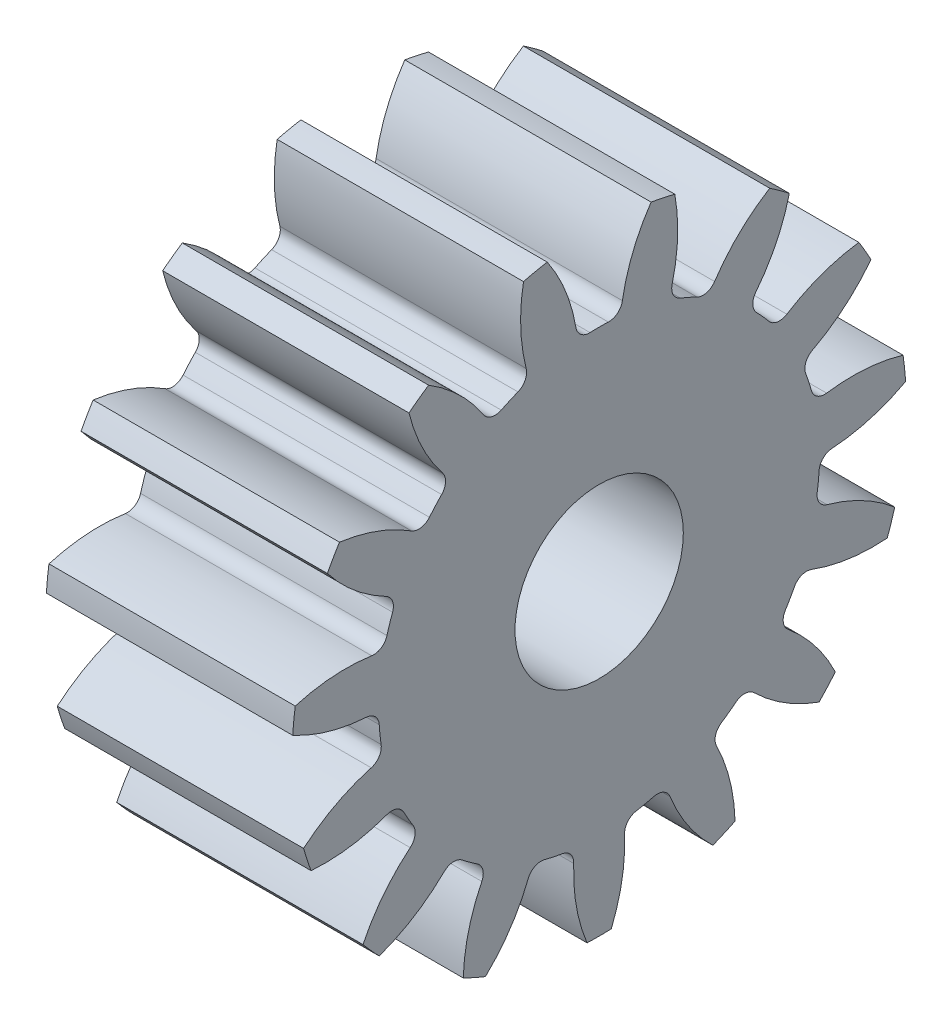
from build123d import *

# Parameters (mm, degrees)
SKETCH1_R                = 9.35
SKETCH1_R_2              = 2.5625
BOSS_EXTRUDE2_DEPTH      = 7.5
CUT_EXTRUDE1_DEPTH       = 16.201809103
FILLET1_R                = 0.418
CIRPATTERN2_COUNT        = 15
FILLET1_OF_CIRPATTERN2_R = 0.418
CUT_EXTRUDE2_REACH       = 25.487
CUT_EXTRUDE2_END_RADIUS  = 2.5625
SKETCH4_R                = 1.5875


with BuildPart() as part:
    # Sketch1 → Boss-Extrude2 (new body)
    with BuildSketch(Plane(origin=(0, 0, 0), x_dir=(0, 0, -1), z_dir=(1, 0, 0))):
        Circle(SKETCH1_R)
        Circle(SKETCH1_R_2, mode=Mode.SUBTRACT)
    extrude(amount=BOSS_EXTRUDE2_DEPTH)

    # Sketch3 → Cut-Extrude1 (cut, through all)
    with BuildSketch(Plane(origin=(7.5, 0, 0), x_dir=(0, 0, -1), z_dir=(1, 0, 0))):
        with BuildLine():
            ThreePointArc((0.657647935, 6.677694152), (0, 6.71), (-0.657647935, 6.677694152))
            ThreePointArc((-0.657647935, 6.677694152), (-0.959446209, 8.00474571), (-1.581267617, 9.215318373))
            ThreePointArc((-1.581267617, 9.215318373), (0, 9.35), (1.581267617, 9.215318373))
            ThreePointArc((1.581267617, 9.215318373), (0.959446209, 8.00474571), (0.657647935, 6.677694152))
        make_face()
    cut_extrude1 = extrude(amount=-CUT_EXTRUDE1_DEPTH, mode=Mode.SUBTRACT)

    # Fillet1
    fillet1_edges = [part.edges().sort_by_distance(p)[0] for p in [
        (3.75, 6.677694152, 0.657647935),
        (3.75, 6.677694152, -0.657647935),
    ]]
    fillet(fillet1_edges, radius=FILLET1_R)

    # CirPattern2: Cut-Extrude1 ×15 about axis
    cirpattern2_axis = Axis((0, 0, 0), (1, 0, 0))
    for i in range(1, CIRPATTERN2_COUNT):
        add(cut_extrude1.rotate(cirpattern2_axis, i * 360 / CIRPATTERN2_COUNT), mode=Mode.SUBTRACT)

    # Fillet1 of CirPattern2
    fillet1_of_cirpattern2_edges = [part.edges().sort_by_distance(p)[0] for p in [
        (3.75, 5.832887647, 3.316854187),
        (3.75, 6.367866674, 2.115271619),
        (3.75, 3.979521877, 5.402546217),
        (3.75, 4.956977197, 4.522441494),
        (3.75, 1.438060622, 6.554088926),
        (3.75, 2.688981331, 6.147640149),
        (3.75, -1.352054379, 6.572370117),
        (3.75, -0.043963837, 6.709855973),
        (3.75, -3.908386895, 5.454228807),
        (3.75, -2.769307258, 6.111876742),
        (3.75, -5.78892381, 3.393001786),
        (3.75, -5.015812295, 4.457098498),
        (3.75, -6.668503208, 0.745093932),
        (3.75, -6.395037819, 2.031647432),
        (3.75, -6.395037819, -2.031647432),
        (3.75, -6.668503208, -0.745093932),
        (3.75, -5.015812295, -4.457098498),
        (3.75, -5.78892381, -3.393001786),
        (3.75, -2.769307258, -6.111876742),
        (3.75, -3.908386895, -5.454228807),
        (3.75, -0.043963837, -6.709855973),
        (3.75, -1.352054379, -6.572370117),
        (3.75, 2.688981331, -6.147640149),
        (3.75, 1.438060622, -6.554088926),
        (3.75, 4.956977197, -4.522441494),
        (3.75, 3.979521877, -5.402546217),
        (3.75, 6.367866674, -2.115271619),
        (3.75, 5.832887647, -3.316854187),
    ]]
    fillet(fillet1_of_cirpattern2_edges, radius=FILLET1_OF_CIRPATTERN2_R)

    # Cut-Extrude2: up to this cylinder (the profile starts outside it)
    cut_extrude2_end = Plane(origin=(3.75, 0, 0), z_dir=(-1, 0, 0)) * Cylinder(CUT_EXTRUDE2_END_RADIUS, 57.099, mode=Mode.PRIVATE)
    # Sketch4 → Cut-Extrude2 (cut, up to the surface)
    with BuildSketch(Plane(origin=(0, -7.455349173, 5.416628235), x_dir=(1, 0, 0), z_dir=(0, 0.8090169943749502, -0.5877852522924691)), mode=Mode.PRIVATE) as cut_extrude2_sk1:
        with Locations(Location((3.75, 0, 0), (0, 0, 90))):
            Circle(SKETCH4_R)
    cut_extrude2_tool1 = extrude(cut_extrude2_sk1.sketch, amount=CUT_EXTRUDE2_REACH, mode=Mode.PRIVATE) - cut_extrude2_end
    add(cut_extrude2_tool1.solids().sort_by_distance((3.75, -7.455349, 5.416628))[0], mode=Mode.SUBTRACT)


solid = part.part
